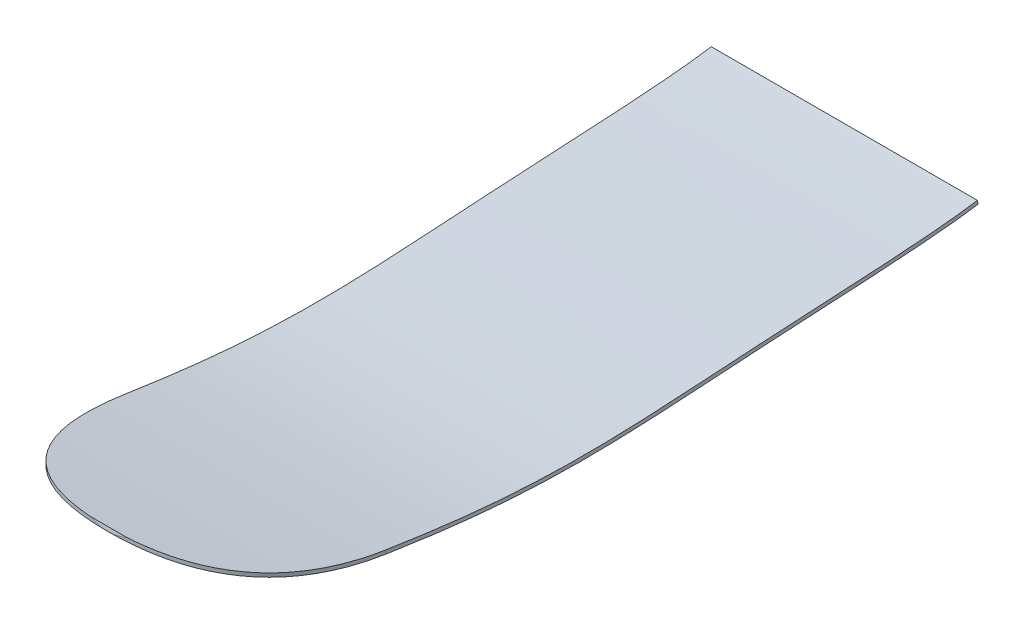
from build123d import *

# Parameters (mm, degrees)
BOSS_EXTRUDE1_DEPTH      = 1524
BOSS_EXTRUDE1_DEPTH_BACK = 1524
CUT_EXTRUDE1_DEPTH       = 3089.4317597
CUT_EXTRUDE1_DEPTH_BACK  = 3089.4317597
SKETCH3_W                = 5731.45735109
SKETCH3_H                = 8003.30588206


with BuildPart() as part:
    # Sketch1 → Boss-Extrude1 (new, two sides: drawn at the far end of the back side and taken through both)
    with BuildSketch(Plane(origin=(0, 0, 0), x_dir=(0, 0, -1), z_dir=(1, 0, 0)).offset(-BOSS_EXTRUDE1_DEPTH_BACK)):
        with BuildLine():
            Line((-2674.592795204, 189.447466859), (-2679.54182478, 164.942220355))
            add(Edge.make_bspline(
                [(-2679.54182478, 164.942220355), (-2679.463177239, 164.926336858), (-2679.328111548, 164.899068653), (-2678.880116073, 164.808685341), (-2678.110774714, 164.653634634), (-2676.817347245, 164.393357449), (-2674.617313445, 163.951326574), (-2670.977978449, 163.221667353), (-2665.215989502, 162.070111154), (-2658.08862209, 160.650292904), (-2646.810931804, 158.411159605), (-2629.46777647, 154.984253035), (-2603.739986003, 149.937309194), (-2573.406059315, 144.032257258), (-2538.782159998, 137.346374128), (-2500.216281348, 129.961448544), (-2458.051920204, 121.958578767), (-2397.493232261, 110.572548491), (-2314.527545672, 95.201713844), (-2206.136376853, 75.568417732), (-2091.554584028, 55.334789121), (-1973.215300308, 35.030498044), (-1853.291875906, 15.118131912), (-1733.673357641, -4.010197968), (-1615.967820486, -22.029537269), (-1501.505084742, -38.680132037), (-1391.349465129, -53.763078011), (-1286.348513153, -67.12692315), (-1187.226170596, -78.641594326), (-1092.81017622, -88.522597615), (-1002.609143192, -96.935731839), (-916.107229423, -104.025604519), (-805.177896295, -111.865582027), (-673.732283959, -118.938998521), (-524.970951591, -123.784839658), (-383.061554501, -125.568798047), (-246.172629688, -124.775621853), (-112.68256806, -121.818514428), (18.910123594, -117.063594992), (150.017542629, -110.8251189), (282.056615481, -103.41736766), (416.465767801, -95.124060203), (531.718511664, -87.71193688), (626.70627153, -81.626832515), (699.565294116, -77.023205819), (774.276676656, -72.417829748), (851.189622154, -67.858883702), (929.590206004, -63.386876497), (1035.753228892, -57.504489786), (1170.774057224, -50.243777445), (1334.200060326, -41.485675175), (1496.59278009, -32.494036065), (1655.501574063, -23.074167576), (1782.941301878, -14.701560542), (1880.658835411, -7.589497721), (1951.516265742, -2.022771942), (2019.630181405, 3.802532415), (2084.692719058, 9.912445944), (2136.114255346, 15.263465538), (2175.422394257, 19.71387408), (2203.951836855, 23.140145091), (2231.492723016, 26.65865631), (2253.589789837, 29.671002568), (2270.736751087, 32.131059411), (2283.32912487, 34.002068073), (2293.589695317, 35.582354423), (2301.67034375, 36.861872038), (2305.643661485, 37.502864312), (2307.637972335, 37.827671556)],
                knots=[0.001962267, 0.001962267, 0.001962267, 0.001962267, 0.002936913, 0.003911559, 0.005860852, 0.007810144, 0.009759437, 0.013658022, 0.017556606, 0.021455191, 0.025353776, 0.033150946, 0.040948116, 0.048745286, 0.056542455, 0.064339625, 0.072136795, 0.079933965, 0.095528304, 0.111122644, 0.126716984, 0.142311323, 0.157905663, 0.173500002, 0.189094342, 0.204688681, 0.220283021, 0.235877361, 0.2514717, 0.26706604, 0.282660379, 0.298254719, 0.313849058, 0.345037738, 0.376226417, 0.407415096, 0.438603775, 0.469792454, 0.500981133, 0.532169813, 0.563358492, 0.594547171, 0.62573585, 0.64133019, 0.656924529, 0.672518869, 0.688113208, 0.703707548, 0.719301888, 0.750490567, 0.781679246, 0.812867925, 0.844056604, 0.875245283, 0.890839623, 0.906433963, 0.922028302, 0.937622642, 0.953216981, 0.961014151, 0.968811321, 0.976608491, 0.98440566, 0.988304245, 0.99220283, 0.996101415, 0.998050708, 1, 1, 1, 1], degree=3))
            Line((2307.637972335, 37.827671556), (2303.619250338, 62.502555011))
            add(Edge.make_bspline(
                [(-2674.592795204, 189.447466859), (-2673.721666651, 189.271535515), (-2665.38289984, 187.589395819), (-2632.677324684, 181.082435045), (-2560.461806594, 166.927667554), (-2453.158953137, 146.349565168), (-2321.868652482, 121.966339794), (-2214.228997552, 102.416692617), (-2100.097320665, 82.202361624), (-1981.948630829, 61.863284624), (-1862.000469752, 41.872383908), (-1742.187583139, 22.632086638), (-1604.482301889, 1.44895814), (-1471.391120368, -17.758411893), (-1372.260084916, -30.960930204), (-1319.897716385, -37.60765471), (-1289.769233197, -41.352925139), (-1266.525755847, -44.162966526), (-1241.474249866, -47.129831785), (-1222.879598868, -49.291683641), (-1204.523908413, -51.373101027), (-1163.985374367, -55.912029546), (-1098.857665042, -62.798420892), (-970.702279581, -74.883972355), (-830.108794801, -85.48150238), (-672.737274123, -93.897515997), (-530.090331047, -98.662618282), (-388.159862591, -100.551732244), (-251.289331972, -99.845546174), (-73.3433777, -95.996995599), (100.818781294, -88.52263397), (276.916498525, -78.678658329), (411.402688762, -70.395310875), (549.832781759, -61.496381448), (669.876616366, -53.810841248), (757.162587874, -48.423060408), (808.157511457, -45.36566702), (937.196277935, -37.778859836), (1112.300148802, -28.340259886), (1330.601839865, -16.644037882), (1547.499538671, -4.642357549), (1757.347612569, 8.207315391), (2046.406304008, 29.94541232), (2209.435961394, 47.163213865), (2303.619250338, 62.502555011)],
                knots=[0.001962267, 0.001962267, 0.001962267, 0.001962267, 0.015625, 0.03125, 0.046875, 0.078125, 0.09375, 0.109375, 0.125, 0.140625, 0.15625, 0.171875, 0.1875, 0.2109375, 0.2265625, 0.23046875, 0.234375, 0.240234375, 0.241210938, 0.24609375, 0.249023438, 0.25, 0.265625, 0.28125, 0.31640625, 0.34375, 0.375, 0.40625, 0.4375, 0.46875, 0.53125, 0.5625, 0.59375, 0.625, 0.65625, 0.671875, 0.6796875, 0.6875, 0.75, 0.78125, 0.8125, 0.875, 0.90625, 1, 1, 1, 1], degree=3))
        make_face()
    extrude(amount=BOSS_EXTRUDE1_DEPTH + BOSS_EXTRUDE1_DEPTH_BACK)

    # Sketch3 → Cut-Extrude1 (cut, two sides: drawn at the far end of the back side and taken through both)
    with BuildSketch(Plane(origin=(0, 0, 0), x_dir=(1, 0, 0), z_dir=(0, 1, 0)).offset(-CUT_EXTRUDE1_DEPTH_BACK)):
        with Locations((35.435462877, -160.908969182)):
            Rectangle(SKETCH3_W, SKETCH3_H)
        with BuildLine():
            Line((-900.000028603, 2541.766216977), (899.999971397, 2541.766216977))
            Line((899.999971397, 2541.766216977), (899.999971397, -1696.791192928))
            add(Edge.make_bspline(
                [(899.999971397, -1696.791192928), (899.999971397, -2679.54182478), (0, -2679.54182478)],
                knots=[0, 0, 0, 1, 1, 1], degree=2))
            add(Edge.make_bspline(
                [(-900.000028603, -1639.076159188), (-900.000028603, -2679.54182478), (0, -2679.54182478)],
                knots=[0, 0, 0, 1, 1, 1], degree=2))
            Line((-900.000028603, -1639.076159188), (-900.000028603, 2541.766216977))
        make_face(mode=Mode.SUBTRACT)
    extrude(amount=CUT_EXTRUDE1_DEPTH + CUT_EXTRUDE1_DEPTH_BACK, mode=Mode.SUBTRACT)


solid = part.part
